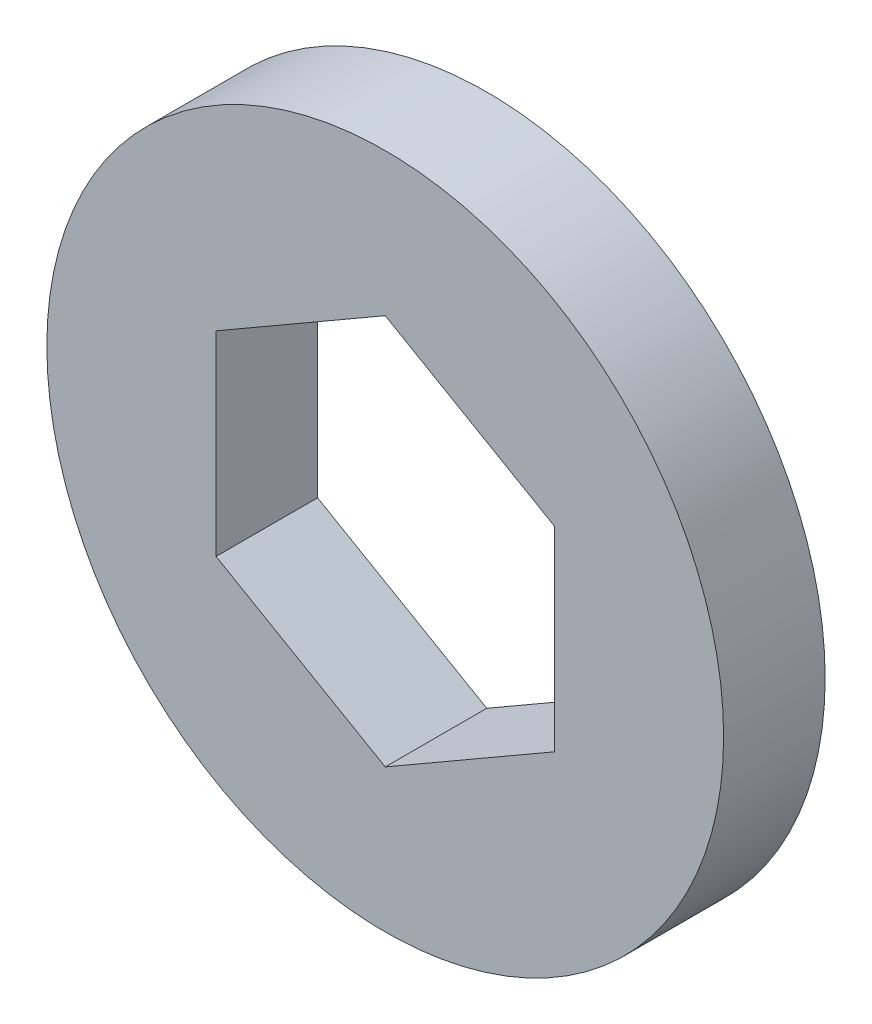
from build123d import *

# Parameters (mm, degrees)
SKETCH1_R           = 50
BOSS_EXTRUDE1_DEPTH = 15


with BuildPart() as part:
    # Sketch1 → Boss-Extrude1 (new body)
    with BuildSketch(Plane.XY):
        Circle(SKETCH1_R)
        Polygon((0, 28.867513459), (-25, 14.43375673), (-25, -14.43375673), (0, -28.867513459), (25, -14.43375673), (25, 14.43375673), align=None, mode=Mode.SUBTRACT)
    extrude(amount=BOSS_EXTRUDE1_DEPTH)


solid = part.part
